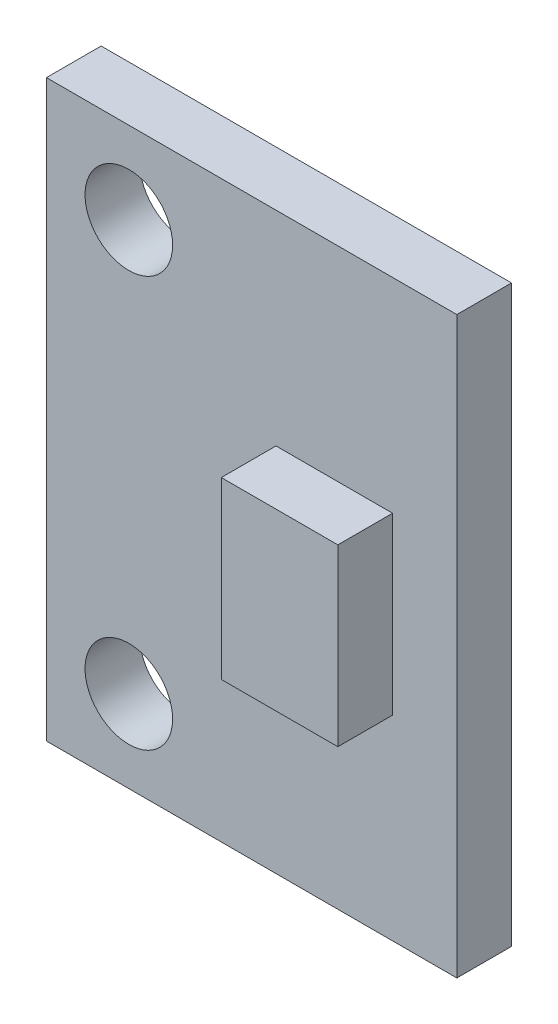
from build123d import *

# Parameters (mm, degrees)
SKETCH1_W           = 15
SKETCH1_H           = 21
SKETCH1_R           = 1.6
BOSS_EXTRUDE1_DEPTH = 2
SKETCH2_W           = 4.260182026
SKETCH2_H           = 6.390273039
BOSS_EXTRUDE2_DEPTH = 2


with BuildPart() as part:
    # Sketch1 → Boss-Extrude1 (new body)
    with BuildSketch(Plane.XY):
        with Locations((-76.94928615, -178.888194031)):
            Rectangle(SKETCH1_W, SKETCH1_H)
        with Locations((-81.438295894, -171.388194031)):
            Circle(SKETCH1_R, mode=Mode.SUBTRACT)
        with Locations((-81.438295894, -186.388194031)):
            Circle(SKETCH1_R, mode=Mode.SUBTRACT)
    extrude(amount=BOSS_EXTRUDE1_DEPTH)

    # Sketch2 → Boss-Extrude2 (add)
    with BuildSketch(Plane.XY.offset(2)):
        with Locations((-73.928674332, -179.047145903)):
            Rectangle(SKETCH2_W, SKETCH2_H)
    extrude(amount=BOSS_EXTRUDE2_DEPTH)


solid = part.part
